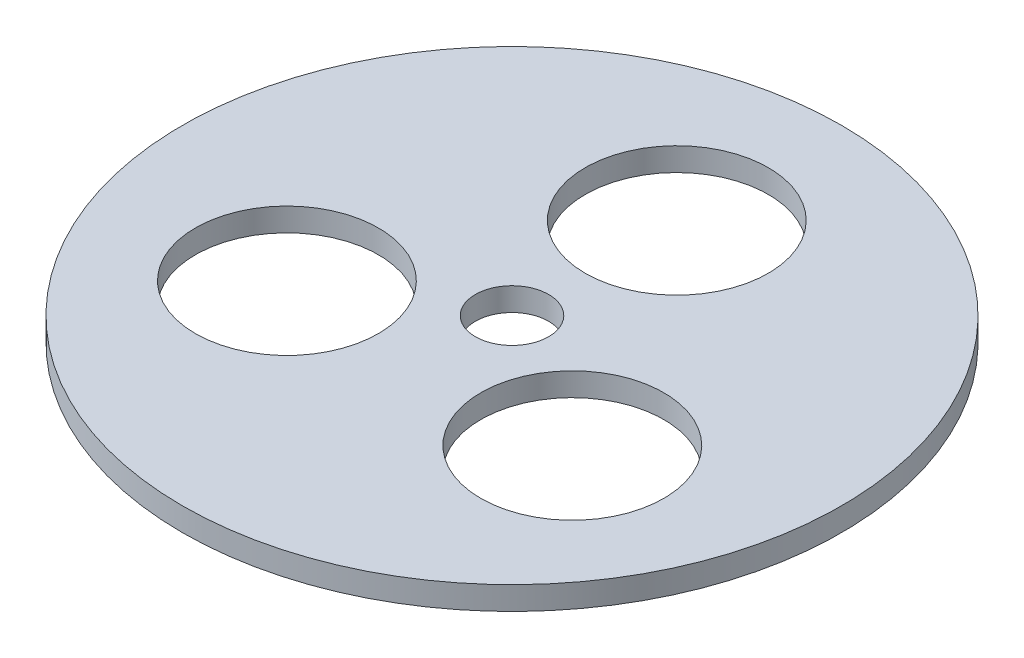
from build123d import *

# Parameters (mm, degrees)
SKETCH1_R           = 45
SKETCH1_R_2         = 12.5
BOSS_EXTRUDE1_DEPTH = 3.175
SKETCH3_R           = 5
CUT_EXTRUDE1_DEPTH  = 6.35
SKETCH4_R           = 1.25
CUT_EXTRUDE2_DEPTH  = 1


with BuildPart() as part:
    # Sketch1 → Boss-Extrude1 (new body)
    with BuildSketch(Plane(origin=(0, 0, 0), x_dir=(1, 0, 0), z_dir=(0, 1, 0))):
        with Locations(Location((0, 0, 0), (0, 0, 270))):
            Circle(SKETCH1_R)
        with Locations(Location((0, 22.5, 0), (0, 0, 270))):
            Circle(SKETCH1_R_2, mode=Mode.SUBTRACT)
        with Locations(Location((19.485571585, -11.25, 0), (0, 0, 270))):
            Circle(SKETCH1_R_2, mode=Mode.SUBTRACT)
        with Locations(Location((-19.485571585, -11.25, 0), (0, 0, 270))):
            Circle(SKETCH1_R_2, mode=Mode.SUBTRACT)
    extrude(amount=BOSS_EXTRUDE1_DEPTH)

    # Sketch3 → Cut-Extrude1 (cut)
    with BuildSketch(Plane(origin=(0, 3.175, 0), x_dir=(1, 0, 0), z_dir=(0, 1, 0))):
        with Locations(Location((0, 0, 0), (0, 0, 270))):
            Circle(SKETCH3_R)
    extrude(amount=-CUT_EXTRUDE1_DEPTH, mode=Mode.SUBTRACT)

    # Sketch4 → Cut-Extrude2 (cut)
    with BuildSketch(Plane.XZ):
        with Locations(Location((0, 12.5, 0), (0, 0, 270))):
            Circle(SKETCH4_R)
        with Locations(Location((10.825317547, -6.25, 0), (0, 0, 90))):
            Circle(SKETCH4_R)
        with Locations(Location((-10.825317547, -6.25, 0), (0, 0, 90))):
            Circle(SKETCH4_R)
    extrude(amount=-CUT_EXTRUDE2_DEPTH, mode=Mode.SUBTRACT)


solid = part.part
